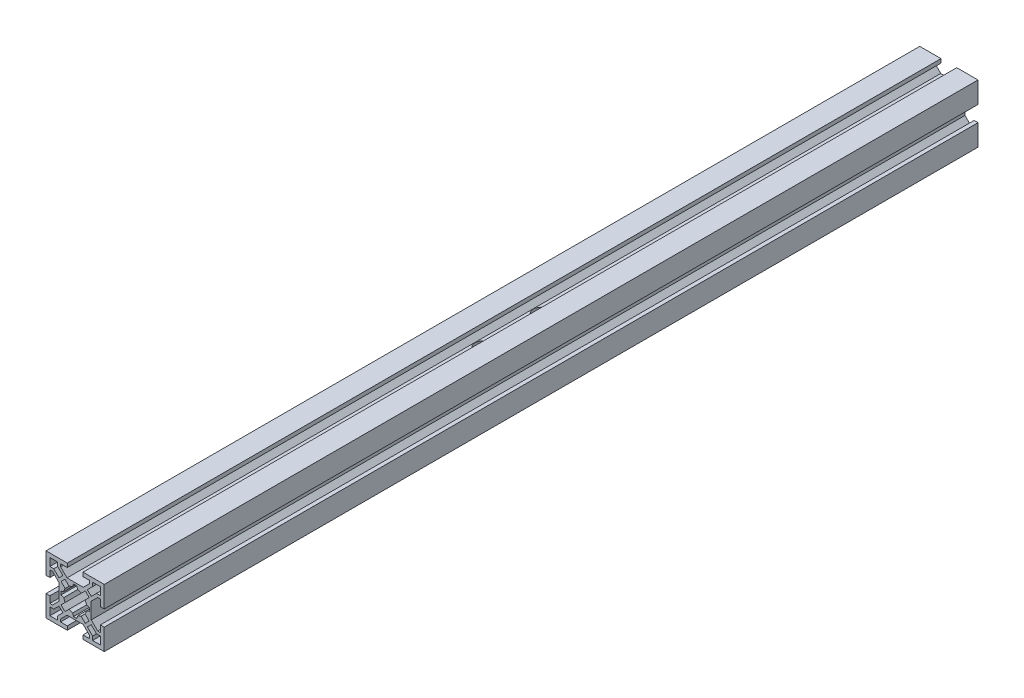
from build123d import *

# Parameters (mm, degrees)
RESSALTO_EXTRUS_O1_DEPTH   = 225
CORTE_EXTRUS_O1_DEPTH      = 226.9977876
CORTE_EXTRUS_O1_DEPTH_BACK = 226.9977876
ESBO_O2_R                  = 4


with BuildPart() as part:
    # Esboço1 → Ressalto-extrusão1 (new, symmetric)
    with BuildSketch(Plane.XY):
        Polygon((-13, -4.05), (-15, -4.05), (-15, -15), (-4.05, -15), (-4.05, -13), (-7.5, -13), (-7.5, -11.627272727), (-4.172727273, -8.3), (4.172727273, -8.3), (7.5, -11.627272727), (7.5, -13), (4.05, -13), (4.05, -15), (15, -15), (15, -4.05), (13, -4.05), (13, -7.5), (11.627272727, -7.5), (8.3, -4.172727273), (8.3, 4.172727273), (11.627272727, 7.5), (13, 7.5), (13, 4.05), (15, 4.05), (15, 15), (4.05, 15), (4.05, 13), (7.5, 13), (7.5, 11.627272727), (4.172727273, 8.3), (-4.172727273, 8.3), (-7.5, 11.627272727), (-7.5, 13), (-4.05, 13), (-4.05, 15), (-15, 15), (-15, 4.05), (-13, 4.05), (-13, 7.5), (-11.627272727, 7.5), (-8.3, 4.172727273), (-8.3, -4.172727273), (-11.627272727, -7.5), (-13, -7.5), align=None)
        with BuildLine():
            Line((-7.239339828, -5.233387445), (-5.125358847, -3.119406464))
            ThreePointArc((-5.125358847, -3.119406464), (-5.566897716, -2.238224702), (-5.858217272, -1.296645823))
            Line((-5.858217272, -1.296645823), (-7.3, -0.859788435))
            Line((-7.3, -0.859788435), (-7.3, 0.859788435))
            Line((-7.3, 0.859788435), (-5.858217272, 1.296645823))
            ThreePointArc((-5.858217272, 1.296645823), (-5.566897716, 2.238224702), (-5.125358847, 3.119406464))
            Line((-5.125358847, 3.119406464), (-7.239339828, 5.233387445))
            Line((-7.239339828, 5.233387445), (-5.233387445, 7.239339828))
            Line((-5.233387445, 7.239339828), (-3.119406464, 5.125358847))
            ThreePointArc((-3.119406464, 5.125358847), (-2.238224702, 5.566897716), (-1.296645823, 5.858217272))
            Line((-1.296645823, 5.858217272), (-0.859788435, 7.3))
            Line((-0.859788435, 7.3), (0.859788435, 7.3))
            Line((0.859788435, 7.3), (1.296645823, 5.858217272))
            ThreePointArc((1.296645823, 5.858217272), (2.238224702, 5.566897716), (3.119406464, 5.125358847))
            Line((3.119406464, 5.125358847), (5.233387445, 7.239339828))
            Line((5.233387445, 7.239339828), (7.239339828, 5.233387445))
            Line((7.239339828, 5.233387445), (5.125358847, 3.119406464))
            ThreePointArc((5.125358847, 3.119406464), (5.566897716, 2.238224702), (5.858217272, 1.296645823))
            Line((5.858217272, 1.296645823), (7.3, 0.859788435))
            Line((7.3, 0.859788435), (7.3, -0.859788435))
            Line((7.3, -0.859788435), (5.858217272, -1.296645823))
            ThreePointArc((5.858217272, -1.296645823), (5.566897716, -2.238224702), (5.125358847, -3.119406464))
            Line((5.125358847, -3.119406464), (7.239339828, -5.233387445))
            Line((7.239339828, -5.233387445), (5.233387445, -7.239339828))
            Line((5.233387445, -7.239339828), (3.119406464, -5.125358847))
            ThreePointArc((3.119406464, -5.125358847), (2.238224702, -5.566897716), (1.296645823, -5.858217272))
            Line((1.296645823, -5.858217272), (0.859788435, -7.3))
            Line((0.859788435, -7.3), (-0.859788435, -7.3))
            Line((-0.859788435, -7.3), (-1.296645823, -5.858217272))
            ThreePointArc((-1.296645823, -5.858217272), (-2.238224702, -5.566897716), (-3.119406464, -5.125358847))
            Line((-3.119406464, -5.125358847), (-5.233387445, -7.239339828))
            Line((-5.233387445, -7.239339828), (-7.239339828, -5.233387445))
        make_face(mode=Mode.SUBTRACT)
        Polygon((-11.005952384, -9), (-13, -9), (-13, -13), (-9, -13), (-9, -11.005952384), (-6.294047616, -8.3), (-8.3, -6.294047616), align=None, mode=Mode.SUBTRACT)
        Polygon((9, -11.005952384), (9, -13), (13, -13), (13, -9), (11.005952384, -9), (8.3, -6.294047616), (6.294047616, -8.3), align=None, mode=Mode.SUBTRACT)
        Polygon((11.005952384, 9), (13, 9), (13, 13), (9, 13), (9, 11.005952384), (6.294047616, 8.3), (8.3, 6.294047616), align=None, mode=Mode.SUBTRACT)
        Polygon((-9, 11.005952384), (-9, 13), (-13, 13), (-13, 9), (-11.005952384, 9), (-8.3, 6.294047616), (-6.294047616, 8.3), align=None, mode=Mode.SUBTRACT)
    extrude(amount=RESSALTO_EXTRUS_O1_DEPTH, both=True)

    # Esboço2 → Corte-extrusão1 (cut, two sides: drawn at the far end of the back side and taken through both)
    with BuildSketch(Plane(origin=(0, 0, 0), x_dir=(1, 0, 0), z_dir=(0, 1, 0)).offset(-CORTE_EXTRUS_O1_DEPTH_BACK)):
        with Locations(Location((0, -15, 0), (0, 0, 282.412424309))):
            Circle(ESBO_O2_R)
        with Locations(Location((0, 15, 0), (0, 0, 282.412424309))):
            Circle(ESBO_O2_R)
    extrude(amount=CORTE_EXTRUS_O1_DEPTH + CORTE_EXTRUS_O1_DEPTH_BACK, mode=Mode.SUBTRACT)


solid = part.part
